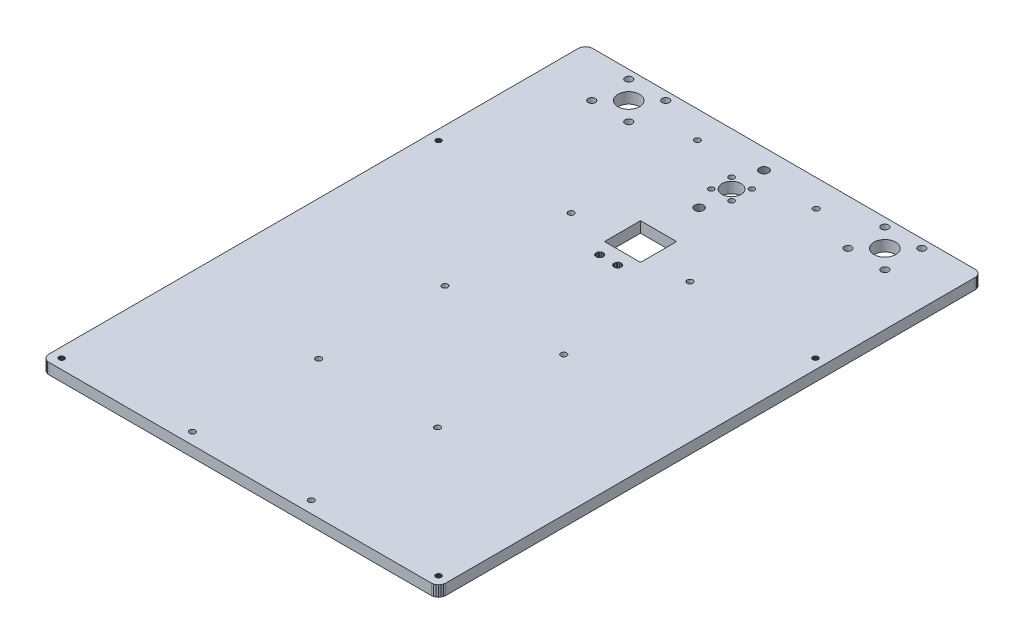
from build123d import *

# Parameters (mm, degrees)
CROQUIS1_R              = 5.25
CROQUIS1_R_2            = 1.5
CROQUIS1_R_3            = 2
CROQUIS1_R_4            = 6
CROQUIS1_R_5            = 1.6
SALIENTE_EXTRUIR1_DEPTH = 6


with BuildPart() as part:
    # Croquis1 → Saliente-Extruir1 (new body)
    with BuildSketch(Plane(origin=(0, 0, 0), x_dir=(1, 0, 0), z_dir=(0, 1, 0))):
        Polygon((-106, -150.736137545), (106, -150.736137545), (107.03527618, -150.59984085), (108, -150.20023916), (108.828427125, -149.56456467), (109.464101615, -148.736137545), (109.863703305, -147.771413726), (110, -146.736137545), (110, 146.736137545), (109.863703305, 147.771413726), (109.464101615, 148.736137545), (108.828427125, 149.56456467), (108, 150.20023916), (107.03527618, 150.59984085), (106, 150.736137545), (-7.156854454, 150.736137545), (-58.746951673, 150.736137545), (-106, 150.736137545), (-107.03527618, 150.59984085), (-108, 150.20023916), (-108.828427125, 149.56456467), (-109.464101615, 148.736137545), (-109.863703305, 147.771413726), (-110, 146.736137545), (-110, -146.736137545), (-109.863703305, -147.771413726), (-109.464101615, -148.736137545), (-108.828427125, -149.56456467), (-108, -150.20023916), (-107.03527618, -150.59984085), align=None)
        with Locations(Location((0, 121.736137545, 0), (0, 0, 270))):
            Circle(CROQUIS1_R, mode=Mode.SUBTRACT)
        with Locations(Location((5.656854045, 127.392991795, 0), (0, 0, 270))):
            Circle(CROQUIS1_R_2, mode=Mode.SUBTRACT)
        with Locations(Location((-5.656854454, 127.392991795, 0), (0, 0, 270))):
            Circle(CROQUIS1_R_2, mode=Mode.SUBTRACT)
        with Locations(Location((-5.656854454, 116.079283296, 0), (0, 0, 270))):
            Circle(CROQUIS1_R_2, mode=Mode.SUBTRACT)
        with Locations(Location((5.656854045, 116.079283296, 0), (0, 0, 270))):
            Circle(CROQUIS1_R_2, mode=Mode.SUBTRACT)
        with Locations(Location((-81.253048327, 145.989185872, 0), (0, 0, 270))):
            Circle(CROQUIS1_R_3, mode=Mode.SUBTRACT)
        with Locations(Location((-60.746951673, 145.989185872, 0), (0, 0, 270))):
            Circle(CROQUIS1_R_3, mode=Mode.SUBTRACT)
        with Locations(Location((-81.253048327, 125.483089218, 0), (0, 0, 270))):
            Circle(CROQUIS1_R_3, mode=Mode.SUBTRACT)
        with Locations(Location((-60.746951673, 125.483089218, 0), (0, 0, 270))):
            Circle(CROQUIS1_R_3, mode=Mode.SUBTRACT)
        with Locations(Location((-71, 135.736137545, 0), (0, 0, 270))):
            Circle(CROQUIS1_R_4, mode=Mode.SUBTRACT)
        with Locations(Location((60.746951673, 145.989185872, 0), (0, 0, 270))):
            Circle(CROQUIS1_R_3, mode=Mode.SUBTRACT)
        with Locations(Location((81.253048327, 145.989185872, 0), (0, 0, 270))):
            Circle(CROQUIS1_R_3, mode=Mode.SUBTRACT)
        with Locations(Location((60.746951673, 125.483089218, 0), (0, 0, 270))):
            Circle(CROQUIS1_R_3, mode=Mode.SUBTRACT)
        with Locations(Location((81.253048327, 125.483089218, 0), (0, 0, 270))):
            Circle(CROQUIS1_R_3, mode=Mode.SUBTRACT)
        with Locations(Location((71, 135.736137545, 0), (0, 0, 270))):
            Circle(CROQUIS1_R_4, mode=Mode.SUBTRACT)
        with Locations(Location((-32.951903064, 135.736137545, 0), (0, 0, 270))):
            Circle(CROQUIS1_R_5, mode=Mode.SUBTRACT)
        with Locations(Location((-32.951903064, 65.736137545, 0), (0, 0, 270))):
            Circle(CROQUIS1_R_5, mode=Mode.SUBTRACT)
        with Locations(Location((-32.951903064, -4.263862455, 0), (0, 0, 270))):
            Circle(CROQUIS1_R_5, mode=Mode.SUBTRACT)
        with Locations(Location((-32.951903064, -74.263862455, 0), (0, 0, 270))):
            Circle(CROQUIS1_R_5, mode=Mode.SUBTRACT)
        with Locations(Location((-32.951903064, -144.263862455, 0), (0, 0, 270))):
            Circle(CROQUIS1_R_5, mode=Mode.SUBTRACT)
        with Locations(Location((32.951903064, -144.263862455, 0), (0, 0, 270))):
            Circle(CROQUIS1_R_5, mode=Mode.SUBTRACT)
        with Locations(Location((32.951903064, -74.263862455, 0), (0, 0, 270))):
            Circle(CROQUIS1_R_5, mode=Mode.SUBTRACT)
        with Locations(Location((32.951903064, -4.263862455, 0), (0, 0, 270))):
            Circle(CROQUIS1_R_5, mode=Mode.SUBTRACT)
        with Locations(Location((32.951903064, 65.736137545, 0), (0, 0, 270))):
            Circle(CROQUIS1_R_5, mode=Mode.SUBTRACT)
        with Locations(Location((32.951903064, 135.736137545, 0), (0, 0, 270))):
            Circle(CROQUIS1_R_5, mode=Mode.SUBTRACT)
        Polygon((-2.478612358, 139.409822065), (-2.500000205, 139.736137545), (-2.478612358, 140.062453026), (-2.414814771, 140.383185158), (-2.309699036, 140.692846126), (-2.165063714, 140.986137545), (-1.983383556, 141.258041118), (-1.767767158, 141.503904498), (-1.521903777, 141.719520896), (-1.250000205, 141.901201055), (-0.956708786, 142.045836376), (-0.647047818, 142.150952111), (-0.326315685, 142.214749699), (-2.05e-07, 142.236137545), (0.326315276, 142.214749699), (0.647047408, 142.150952111), (0.956708376, 142.045836376), (1.249999795, 141.901201055), (1.521903368, 141.719520896), (1.767766748, 141.503904498), (1.983383146, 141.258041118), (2.165063305, 140.986137545), (2.309698626, 140.692846126), (2.414814361, 140.383185158), (2.478611949, 140.062453026), (2.499999795, 139.736137545), (2.478611949, 139.409822065), (2.414814361, 139.089089932), (2.309698626, 138.779428964), (2.165063305, 138.486137545), (1.983383146, 138.214233973), (1.767766748, 137.968370592), (1.521903368, 137.752754194), (1.249999795, 137.571074036), (0.956708376, 137.426438714), (0.647047408, 137.321322979), (0.326315276, 137.257525392), (-2.05e-07, 137.236137545), (-0.326315685, 137.257525392), (-0.647047818, 137.321322979), (-0.956708786, 137.426438714), (-1.250000205, 137.571074036), (-1.521903777, 137.752754194), (-1.767767158, 137.968370592), (-1.983383556, 138.214233973), (-2.165063714, 138.486137545), (-2.309699036, 138.779428964), (-2.414814771, 139.089089932), align=None, mode=Mode.SUBTRACT)
        Polygon((-2.414814771, 103.089089932), (-2.478612358, 103.409822065), (-2.500000205, 103.736137545), (-2.478612358, 104.062453026), (-2.414814771, 104.383185158), (-2.309699036, 104.692846126), (-2.165063714, 104.986137545), (-1.983383556, 105.258041118), (-1.767767158, 105.503904498), (-1.521903777, 105.719520896), (-1.250000205, 105.901201055), (-0.956708786, 106.045836376), (-0.647047818, 106.150952111), (-0.326315685, 106.214749699), (-2.05e-07, 106.236137545), (0.326315276, 106.214749699), (0.647047408, 106.150952111), (0.956708376, 106.045836376), (1.249999795, 105.901201055), (1.521903368, 105.719520896), (1.767766748, 105.503904498), (1.983383146, 105.258041118), (2.165063305, 104.986137545), (2.309698626, 104.692846126), (2.414814361, 104.383185158), (2.478611949, 104.062453026), (2.499999795, 103.736137545), (2.478611949, 103.409822065), (2.414814361, 103.089089932), (2.309698626, 102.779428964), (2.165063305, 102.486137545), (1.983383146, 102.214233973), (1.767766748, 101.968370592), (1.521903368, 101.752754194), (1.249999795, 101.571074036), (0.956708376, 101.426438714), (0.647047408, 101.321322979), (0.326315276, 101.257525392), (-2.05e-07, 101.236137545), (-0.326315685, 101.257525392), (-0.647047818, 101.321322979), (-0.956708786, 101.426438714), (-1.250000205, 101.571074036), (-1.521903777, 101.752754194), (-1.767767158, 101.968370592), (-1.983383556, 102.214233973), (-2.165063714, 102.486137545), (-2.309699036, 102.779428964), align=None, mode=Mode.SUBTRACT)
        Polygon((-9, 81.263862455), (9, 81.263862455), (10, 81.263862455), (10, 80.263862455), (10, 62.263862455), (10, 61.263862455), (9, 61.263862455), (-9, 61.263862455), (-10, 61.263862455), (-10, 62.263862455), (-10, 80.263862455), (-10, 81.263862455), align=None, mode=Mode.SUBTRACT)
        Polygon((3.068148296, 53.089293137), (2.999999949, 53.606931227), (3.068148296, 54.124569318), (3.267949141, 54.606931227), (3.585786386, 55.02114479), (3.999999949, 55.338982035), (4.482361859, 55.53878288), (4.999999949, 55.606931227), (5.517638039, 55.53878288), (5.999999949, 55.338982035), (6.414213511, 55.02114479), (6.732050756, 54.606931227), (6.931851601, 54.124569318), (6.999999949, 53.606931227), (6.931851601, 53.089293137), (6.732050756, 52.606931227), (6.414213511, 52.192717665), (5.999999949, 51.87488042), (5.517638039, 51.675079575), (4.999999949, 51.606931227), (4.482361859, 51.675079575), (3.999999949, 51.87488042), (3.585786386, 52.192717665), (3.267949141, 52.606931227), align=None, mode=Mode.SUBTRACT)
        Polygon((-105.948888739, -145.624366113), (-106, -145.236137545), (-105.948888739, -144.847908978), (-105.799038106, -144.486137545), (-105.560660172, -144.175477373), (-105.25, -143.93709944), (-104.888228568, -143.787248806), (-104.5, -143.736137545), (-104.111771432, -143.787248806), (-103.75, -143.93709944), (-103.439339828, -144.175477373), (-103.200961894, -144.486137545), (-103.051111261, -144.847908978), (-103, -145.236137545), (-103.051111261, -145.624366113), (-103.200961894, -145.986137545), (-103.439339828, -146.296797717), (-103.75, -146.535175651), (-104.111771432, -146.685026285), (-104.5, -146.736137545), (-104.888228568, -146.685026285), (-105.25, -146.535175651), (-105.560660172, -146.296797717), (-105.799038106, -145.986137545), align=None, mode=Mode.SUBTRACT)
        Polygon((103.200961894, -145.986137545), (103.051111261, -145.624366113), (103, -145.236137545), (103.051111261, -144.847908978), (103.200961894, -144.486137545), (103.439339828, -144.175477373), (103.75, -143.93709944), (104.111771432, -143.787248806), (104.5, -143.736137545), (104.888228568, -143.787248806), (105.25, -143.93709944), (105.560660172, -144.175477373), (105.799038106, -144.486137545), (105.948888739, -144.847908978), (106, -145.236137545), (105.948888739, -145.624366113), (105.799038106, -145.986137545), (105.560660172, -146.296797717), (105.25, -146.535175651), (104.888228568, -146.685026285), (104.5, -146.736137545), (104.111771432, -146.685026285), (103.75, -146.535175651), (103.439339828, -146.296797717), align=None, mode=Mode.SUBTRACT)
        Polygon((-106, 63.763862455), (-105.948888739, 64.152091022), (-105.799038106, 64.513862455), (-105.560660172, 64.824522627), (-105.25, 65.06290056), (-104.888228568, 65.212751194), (-104.5, 65.263862455), (-104.111771432, 65.212751194), (-103.75, 65.06290056), (-103.439339828, 64.824522627), (-103.200961894, 64.513862455), (-103.051111261, 64.152091022), (-103, 63.763862455), (-103.051111261, 63.375633887), (-103.200961894, 63.013862455), (-103.439339828, 62.703202283), (-103.75, 62.464824349), (-104.111771432, 62.314973715), (-104.5, 62.263862455), (-104.888228568, 62.314973715), (-105.25, 62.464824349), (-105.560660172, 62.703202283), (-105.799038106, 63.013862455), (-105.948888739, 63.375633887), align=None, mode=Mode.SUBTRACT)
        Polygon((103, 63.763862455), (103.051111261, 64.152091022), (103.200961894, 64.513862455), (103.439339828, 64.824522627), (103.75, 65.06290056), (104.111771432, 65.212751194), (104.5, 65.263862455), (104.888228568, 65.212751194), (105.25, 65.06290056), (105.560660172, 64.824522627), (105.799038106, 64.513862455), (105.948888739, 64.152091022), (106, 63.763862455), (105.948888739, 63.375633887), (105.799038106, 63.013862455), (105.560660172, 62.703202283), (105.25, 62.464824349), (104.888228568, 62.314973715), (104.5, 62.263862455), (104.111771432, 62.314973715), (103.75, 62.464824349), (103.439339828, 62.703202283), (103.200961894, 63.013862455), (103.051111261, 63.375633887), align=None, mode=Mode.SUBTRACT)
        Polygon((-7.000000051, 53.606931227), (-6.931851704, 54.124569318), (-6.732050859, 54.606931227), (-6.414213614, 55.02114479), (-6.000000051, 55.338982035), (-5.517638141, 55.53878288), (-5.000000051, 55.606931227), (-4.482361961, 55.53878288), (-4.000000051, 55.338982035), (-3.585786489, 55.02114479), (-3.267949244, 54.606931227), (-3.068148399, 54.124569318), (-3.000000051, 53.606931227), (-3.068148399, 53.089293137), (-3.267949244, 52.606931227), (-3.585786489, 52.192717665), (-4.000000051, 51.87488042), (-4.482361961, 51.675079575), (-5.000000051, 51.606931227), (-5.517638141, 51.675079575), (-6.000000051, 51.87488042), (-6.414213614, 52.192717665), (-6.732050859, 52.606931227), (-6.931851704, 53.089293137), align=None, mode=Mode.SUBTRACT)
    extrude(amount=SALIENTE_EXTRUIR1_DEPTH)


solid = part.part
